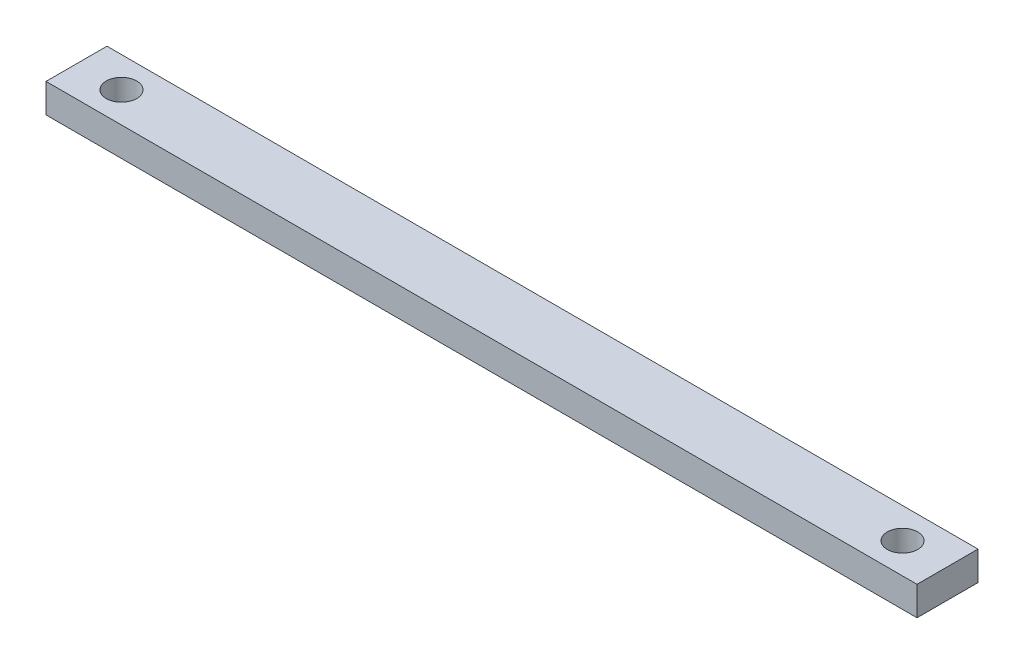
from build123d import *

# Parameters (mm, degrees)
ESQUISSE1_W             = 600
ESQUISSE1_H             = 42
BOSS_EXTRU_1_DEPTH      = 20
ESQUISSE2_R             = 10.5
ENL_V_MAT_EXTRU_1_DEPTH = 20


with BuildPart() as part:
    # Esquisse1 → Boss.-Extru.1 (new body)
    with BuildSketch(Plane(origin=(0, 0, 0), x_dir=(1, 0, 0), z_dir=(0, 1, 0))):
        Rectangle(ESQUISSE1_W, ESQUISSE1_H)
    extrude(amount=BOSS_EXTRU_1_DEPTH)

    # Esquisse2 → Enlèv. mat.-Extru.1 (cut)
    with BuildSketch(Plane(origin=(0, 20, 0), x_dir=(1, 0, 0), z_dir=(0, 1, 0))):
        with Locations(Location((-269, 0, 0), (0, 0, 270))):
            Circle(ESQUISSE2_R)
        with Locations(Location((269, 0, 0), (0, 0, 270))):
            Circle(ESQUISSE2_R)
    extrude(amount=-ENL_V_MAT_EXTRU_1_DEPTH, mode=Mode.SUBTRACT)


solid = part.part
